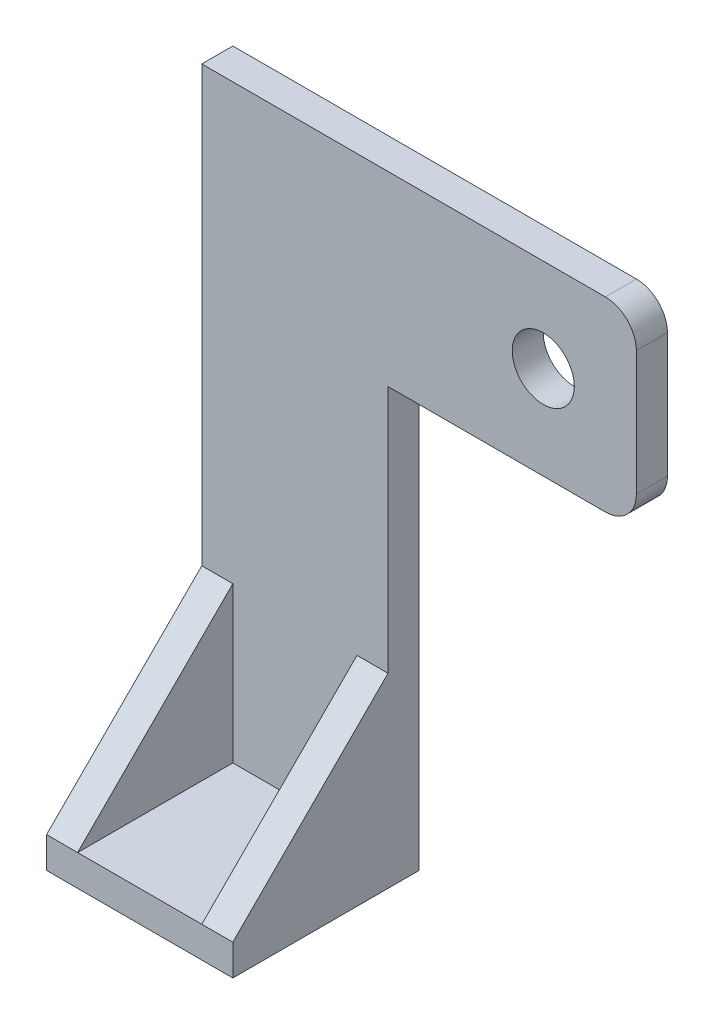
from build123d import *

# Parameters (mm, degrees)
BOSS_EXTRUDE1_DEPTH = 5
SKETCH2_R           = 5
CUT_EXTRUDE1_DEPTH  = 10
SKETCH3_W           = 30
SKETCH3_H           = 30
BOSS_EXTRUDE2_DEPTH = 5
BOSS_EXTRUDE3_DEPTH = 5
SKETCH6_R           = 5
CUT_EXTRUDE2_DEPTH  = 5
SKETCH7_W           = 46.54134698
SKETCH7_H           = 34.044615897
CUT_EXTRUDE3_DEPTH  = 5


with BuildPart() as part:
    # Sketch1 → Boss-Extrude1 (new body)
    with BuildSketch(Plane.XY):
        with BuildLine():
            Line((5, 0), (70, 0))
            Line((70, 0), (70, -30))
            Line((70, -30), (70, -95))
            Line((70, -95), (40, -95))
            Line((40, -95), (40, -30))
            Line((40, -30), (5, -30))
            ThreePointArc((5, -30), (1.464466094, -28.535533906), (0, -25))
            Line((0, -25), (0, -5))
            ThreePointArc((0, -5), (1.464466094, -1.464466094), (5, 0))
        make_face()
    boss_extrude1 = extrude(amount=BOSS_EXTRUDE1_DEPTH)

    # Sketch2 → Cut-Extrude1 (cut)
    with BuildSketch(Plane.XY.offset(5)):
        with Locations((15, -15)):
            Circle(SKETCH2_R)
    extrude(amount=-CUT_EXTRUDE1_DEPTH, mode=Mode.SUBTRACT)

    # Sketch3 → Boss-Extrude2 (add)
    with BuildSketch(Plane.XZ.offset(95)):
        with Locations((55, 15)):
            Rectangle(SKETCH3_W, SKETCH3_H)
    extrude(amount=BOSS_EXTRUDE2_DEPTH)

    # Sketch4 → Boss-Extrude3 (add)
    with BuildSketch(Plane.ZY.offset(-40)):
        Polygon((5, -70), (30, -95), (5, -95), align=None)
    boss_extrude3 = extrude(amount=-BOSS_EXTRUDE3_DEPTH)

    # Mirror1: Boss-Extrude3 across plane
    add(boss_extrude3.mirror(Plane.ZY.offset(-55)))

    # Mirror2: Boss-Extrude1 across plane
    add(boss_extrude1.mirror(Plane.ZY.offset(-55)))

    # Sketch6 → Cut-Extrude2 (cut)
    with BuildSketch(Plane.XY.offset(5)):
        with Locations((95, -15)):
            Circle(SKETCH6_R)
    extrude(amount=-CUT_EXTRUDE2_DEPTH, mode=Mode.SUBTRACT)

    # Sketch7 → Cut-Extrude3 (cut)
    with BuildSketch(Plane.XY.offset(5)):
        with Locations((16.72932651, -12.977692052)):
            Rectangle(SKETCH7_W, SKETCH7_H)
    extrude(amount=-CUT_EXTRUDE3_DEPTH, mode=Mode.SUBTRACT)


solid = part.part
